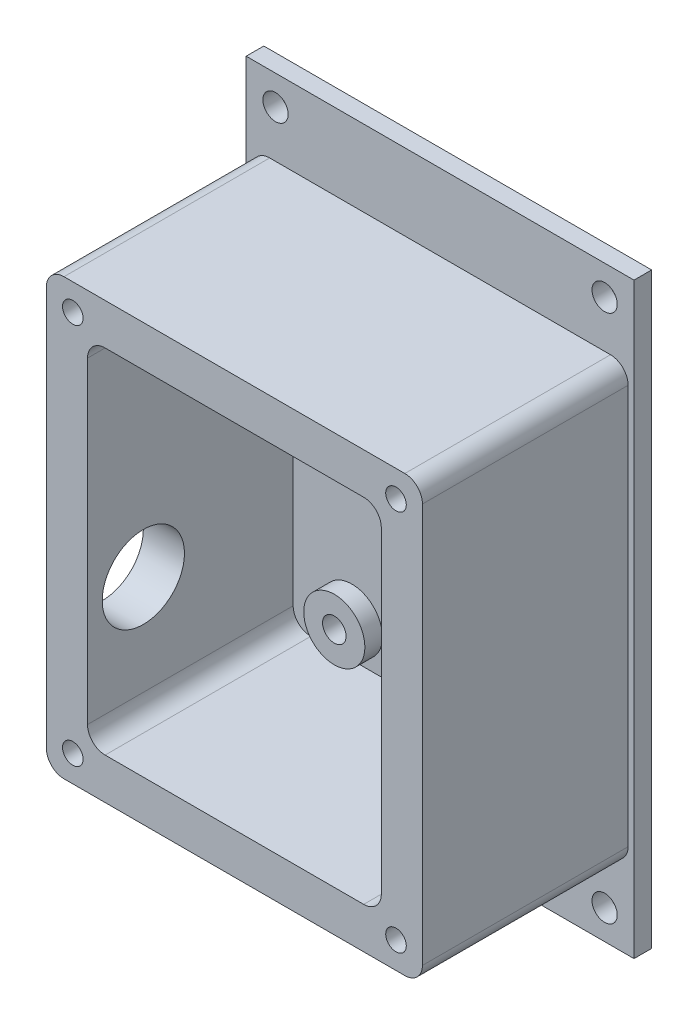
from build123d import *

# Parameters (mm, degrees)
SKICA1_W                    = 50
SKICA1_H                    = 60
P_IDAT_VYSUNUT_M2_DEPTH     = 3
SKICA3_W                    = 64
SKICA3_H                    = 74
SKICA3_W_2                  = 50
SKICA3_H_2                  = 60
VYSUNOUT_TENKOST_NN_1_DEPTH = 35
SKICA4_W                    = 66
SKICA4_H                    = 100
SKICA4_R                    = 2.15
SKICA4_W_2                  = 50
SKICA4_H_2                  = 60
P_IDAT_VYSUNUT_M5_DEPTH     = 3
SKICA2_R                    = 5.2
SKICA2_R_2                  = 2
VYSUNOUT_TENKOST_NN_2_DEPTH = 3
ZAOBLIT2_R                  = 3
ODEBRAT_VYSUNUT_M3_REACH    = 107.868
SKICA9_R                    = 7
ZAOBLIT4_R                  = 3
ZAOBLIT5_R                  = 3
ZAOBLIT6_R                  = 3
ZAOBLIT7_R                  = 3
SKICA10_R                   = 1.75
ODEBRAT_VYSUNUT_M4_DEPTH    = 5


with BuildPart() as part:
    # Skica1 → Přidat vysunutím2 (new body)
    with BuildSketch(Plane.XY):
        with Locations((25, 30)):
            Rectangle(SKICA1_W, SKICA1_H)
    extrude(amount=P_IDAT_VYSUNUT_M2_DEPTH)



with BuildPart() as body_2:
    # Skica3 → Vysunout tenkostěnný1 (new body)
    with BuildSketch(Plane.XY.offset(3)):
        with Locations((25, 30)):
            Rectangle(SKICA3_W, SKICA3_H)
        with Locations((25, 30)):
            Rectangle(SKICA3_W_2, SKICA3_H_2, mode=Mode.SUBTRACT)
    extrude(amount=VYSUNOUT_TENKOST_NN_1_DEPTH)


with BuildPart() as part_1:
    add(part.part)

    add(body_2.part)  # Přidat vysunutím5 merges body 2
    # Skica4 → Přidat vysunutím5 (add)
    with BuildSketch(Plane(origin=(0, 0, 0), x_dir=(-1, 0, 0), z_dir=(0, 0, -1))):
        with Locations((-25, 30)):
            Rectangle(SKICA4_W, SKICA4_H)
        with Locations((-53, 75)):
            Circle(SKICA4_R, mode=Mode.SUBTRACT)
        with Locations((3, 75)):
            Circle(SKICA4_R, mode=Mode.SUBTRACT)
        with Locations((3, -15)):
            Circle(SKICA4_R, mode=Mode.SUBTRACT)
        with Locations((-53, -15)):
            Circle(SKICA4_R, mode=Mode.SUBTRACT)
        with Locations((-25, 30)):
            Rectangle(SKICA4_W_2, SKICA4_H_2, mode=Mode.SUBTRACT)
    extrude(amount=-P_IDAT_VYSUNUT_M5_DEPTH)

    # Skica2 → Vysunout tenkostěnný2 (add)
    # profile 1 of 4: a face of its own
    with BuildSketch(Plane.XY.offset(3)):
        with Locations((10, 54.5)):
            Circle(SKICA2_R)
        with Locations((10, 54.5)):
            Circle(SKICA2_R_2, mode=Mode.SUBTRACT)
    # profile 2 of 4: a face of its own
    with BuildSketch(Plane.XY.offset(3)):
        with Locations((36, 54.5)):
            Circle(SKICA2_R)
        with Locations((36, 54.5)):
            Circle(SKICA2_R_2, mode=Mode.SUBTRACT)
    # profile 3 of 4: a face of its own
    with BuildSketch(Plane.XY.offset(3)):
        with Locations((36, 6)):
            Circle(SKICA2_R)
        with Locations((36, 6)):
            Circle(SKICA2_R_2, mode=Mode.SUBTRACT)
    # profile 4 of 4: a face of its own
    with BuildSketch(Plane.XY.offset(3)):
        with Locations((10, 6)):
            Circle(SKICA2_R)
        with Locations((10, 6)):
            Circle(SKICA2_R_2, mode=Mode.SUBTRACT)
    extrude(amount=VYSUNOUT_TENKOST_NN_2_DEPTH)

    # Zaoblit2
    zaoblit2_edges = [part_1.edges().sort_by_distance(p)[0] for p in [
        (-7, 67, 20.5),
        (-7, -7, 20.5),
        (57, -7, 20.5),
        (57, 67, 20.5),
    ]]
    fillet(zaoblit2_edges, radius=ZAOBLIT2_R)

    # Skica9 → Odebrat vysunutím3 (cut, up to next)
    with BuildSketch(Plane(origin=(0, 0, 0), x_dir=(0, 0, -1), z_dir=(1, 0, 0)), mode=Mode.PRIVATE) as odebrat_vysunut_m3_sk1:
        with Locations((-28.5, 20)):
            Circle(SKICA9_R)
    odebrat_vysunut_m3_tool1 = extrude(odebrat_vysunut_m3_sk1.sketch, amount=-ODEBRAT_VYSUNUT_M3_REACH, mode=Mode.PRIVATE) & part_1.part
    add(odebrat_vysunut_m3_tool1.solids().sort_by_distance((0, 20, 28.5))[0], mode=Mode.SUBTRACT)

    # Zaoblit4
    zaoblit4_edges = [part_1.edges().sort_by_distance(p)[0] for p in [
        (50, 60, 20.5),
    ]]
    fillet(zaoblit4_edges, radius=ZAOBLIT4_R)

    # Zaoblit5
    zaoblit5_edges = [part_1.edges().sort_by_distance(p)[0] for p in [
        (50, 0, 20.5),
    ]]
    fillet(zaoblit5_edges, radius=ZAOBLIT5_R)

    # Zaoblit6
    zaoblit6_edges = [part_1.edges().sort_by_distance(p)[0] for p in [
        (0, 0, 20.5),
    ]]
    fillet(zaoblit6_edges, radius=ZAOBLIT6_R)

    # Zaoblit7
    zaoblit7_edges = [part_1.edges().sort_by_distance(p)[0] for p in [
        (0, 60, 20.5),
    ]]
    fillet(zaoblit7_edges, radius=ZAOBLIT7_R)

    # Skica10 → Odebrat vysunutím4 (cut)
    with BuildSketch(Plane.XY.offset(38)):
        with Locations((-2.5, 62.5)):
            Circle(SKICA10_R)
        with Locations((52.5, 62.5)):
            Circle(SKICA10_R)
        with Locations((52.5, -2.5)):
            Circle(SKICA10_R)
        with Locations((-2.5, -2.5)):
            Circle(SKICA10_R)
    extrude(amount=-ODEBRAT_VYSUNUT_M4_DEPTH, mode=Mode.SUBTRACT)


solid = part_1.part
